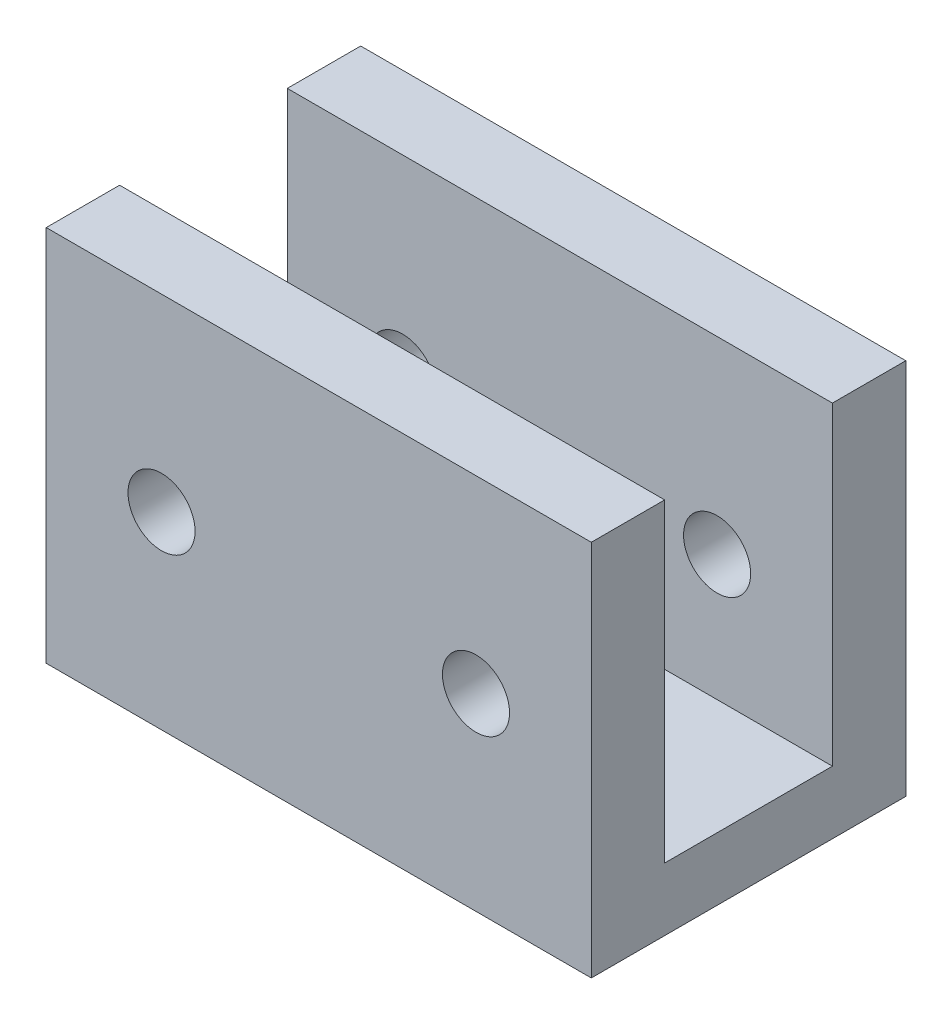
from build123d import *

# Parameters (mm, degrees)
SKETCH_1_W          = 26
SKETCH_1_H          = 18
SKETCH_1_R          = 1.6
EXTRUDE_1_DEPTH     = 7.5
SKETCH_3_W          = 8
SKETCH_3_H          = 15
CUT_EXTRUDE_2_DEPTH = 30


with BuildPart() as part:
    # 草图1 → 凸台-拉伸1 (new, symmetric)
    with BuildSketch(Plane.XY):
        Rectangle(SKETCH_1_W, SKETCH_1_H)
        with Locations((-7.5, 0)):
            Circle(SKETCH_1_R, mode=Mode.SUBTRACT)
        with Locations(Location((7.5, 0, 0), (0, 0, 180))):
            Circle(SKETCH_1_R, mode=Mode.SUBTRACT)
    extrude(amount=EXTRUDE_1_DEPTH, both=True)

    # 草图3 → 切除-拉伸2 (cut)
    with BuildSketch(Plane.ZY.offset(13)):
        with Locations((0, 1.5)):
            Rectangle(SKETCH_3_W, SKETCH_3_H)
    extrude(amount=-CUT_EXTRUDE_2_DEPTH, mode=Mode.SUBTRACT)


solid = part.part
